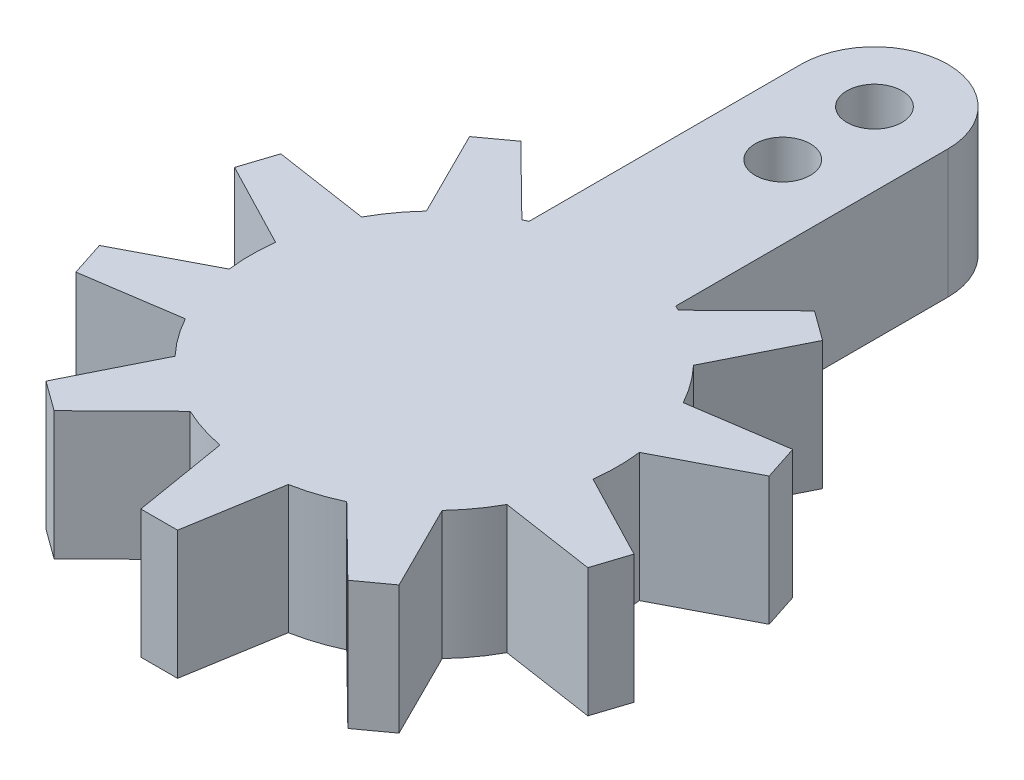
from build123d import *

# Parameters (mm, degrees)
BOSS_EXTRUDE2_DEPTH = 7
SKETCH2_R           = 1.5
BOSS_EXTRUDE3_DEPTH = 7


with BuildPart() as part:
    # Sketch1 → Boss-Extrude2 (new body)
    with BuildSketch(Plane(origin=(0, 0, 0), x_dir=(1, 0, 0), z_dir=(0, 1, 0))):
        with BuildLine():
            Line((-2, 9), (-1.862495894, 9.825024633))
            ThreePointArc((-1.862495894, 9.825024633), (-3.090169944, 9.510565163), (-4.268213752, 9.043359518))
            Line((-4.268213752, 9.043359518), (-3.672033282, 8.456723454))
            Line((-3.672033282, 8.456723454), (-6.908101259, 6.105582445))
            Line((-6.908101259, 6.105582445), (-7.281795413, 6.853864279))
            ThreePointArc((-7.281795413, 6.853864279), (-8.090169944, 5.877852523), (-8.768610817, 4.807438439))
            Line((-8.768610817, 4.807438439), (-7.941474658, 4.683265982))
            Line((-7.941474658, 4.683265982), (-9.177542635, 0.879039917))
            Line((-9.177542635, 0.879039917), (-9.919696584, 1.264760725))
            ThreePointArc((-9.919696584, 1.264760725), (-10, 0), (-9.919696584, -1.264760725))
            Line((-9.919696584, -1.264760725), (-9.177542635, -0.879039917))
            Line((-9.177542635, -0.879039917), (-7.941474658, -4.683265982))
            Line((-7.941474658, -4.683265982), (-8.768610817, -4.807438439))
            ThreePointArc((-8.768610817, -4.807438439), (-8.090169944, -5.877852523), (-7.281795413, -6.853864279))
            Line((-7.281795413, -6.853864279), (-6.908101259, -6.105582445))
            Line((-6.908101259, -6.105582445), (-3.672033282, -8.456723454))
            Line((-3.672033282, -8.456723454), (-4.268213752, -9.043359518))
            ThreePointArc((-4.268213752, -9.043359518), (-3.090169944, -9.510565163), (-1.862495894, -9.825024633))
            Line((-1.862495894, -9.825024633), (-2, -9))
            Line((-2, -9), (2, -9))
            Line((2, -9), (1.862495894, -9.825024633))
            ThreePointArc((1.862495894, -9.825024633), (3.090169944, -9.510565163), (4.268213752, -9.043359518))
            Line((4.268213752, -9.043359518), (3.672033282, -8.456723454))
            Line((3.672033282, -8.456723454), (6.908101259, -6.105582445))
            Line((6.908101259, -6.105582445), (7.281795413, -6.853864279))
            ThreePointArc((7.281795413, -6.853864279), (8.090169944, -5.877852523), (8.768610817, -4.807438439))
            Line((8.768610817, -4.807438439), (7.941474658, -4.683265982))
            Line((7.941474658, -4.683265982), (9.177542635, -0.879039917))
            Line((9.177542635, -0.879039917), (9.919696584, -1.264760725))
            ThreePointArc((9.919696584, -1.264760725), (9.979903953, -0.633653756), (10, 0))
            ThreePointArc((10, 0), (9.979903953, 0.633653756), (9.919696584, 1.264760725))
            Line((9.919696584, 1.264760725), (9.177542635, 0.879039917))
            Line((9.177542635, 0.879039917), (7.941474658, 4.683265982))
            Line((7.941474658, 4.683265982), (8.768610817, 4.807438439))
            ThreePointArc((8.768610817, 4.807438439), (8.090169944, 5.877852523), (7.281795413, 6.853864279))
            Line((7.281795413, 6.853864279), (6.908101259, 6.105582445))
            Line((6.908101259, 6.105582445), (3.672033282, 8.456723454))
            Line((3.672033282, 8.456723454), (4.268213752, 9.043359518))
            ThreePointArc((4.268213752, 9.043359518), (3.090169944, 9.510565163), (1.862495894, 9.825024633))
            Line((1.862495894, 9.825024633), (2, 9))
            Line((2, 9), (-2, 9))
        make_face()
        with BuildLine():
            ThreePointArc((-8.768610817, -4.807438439), (-9.510565163, -3.090169944), (-9.919696584, -1.264760725))
            Line((-9.919696584, -1.264760725), (-14.574864739, -3.684198399))
            Line((-14.574864739, -3.684198399), (-13.95683075, -5.586311432))
            Line((-13.95683075, -5.586311432), (-8.768610817, -4.807438439))
        make_face()
        with BuildLine():
            ThreePointArc((-4.268213752, -9.043359518), (-5.877852523, -8.090169944), (-7.281795413, -6.853864279))
            Line((-7.281795413, -6.853864279), (-9.625795779, -11.547469663))
            Line((-9.625795779, -11.547469663), (-8.00776179, -12.723040168))
            Line((-8.00776179, -12.723040168), (-4.268213752, -9.043359518))
        make_face()
        with BuildLine():
            ThreePointArc((1.862495894, -9.825024633), (0, -10), (-1.862495894, -9.825024633))
            Line((-1.862495894, -9.825024633), (-1, -15))
            Line((-1, -15), (1, -15))
            Line((1, -15), (1.862495894, -9.825024633))
        make_face()
        with BuildLine():
            Line((9.625795779, -11.547469663), (7.281795413, -6.853864279))
            ThreePointArc((7.281795413, -6.853864279), (5.877852523, -8.090169944), (4.268213752, -9.043359518))
            Line((4.268213752, -9.043359518), (8.00776179, -12.723040168))
            Line((8.00776179, -12.723040168), (9.625795779, -11.547469663))
        make_face()
        with BuildLine():
            Line((14.574864739, -3.684198399), (9.919696584, -1.264760725))
            ThreePointArc((9.919696584, -1.264760725), (9.510565163, -3.090169944), (8.768610817, -4.807438439))
            Line((8.768610817, -4.807438439), (13.95683075, -5.586311432))
            Line((13.95683075, -5.586311432), (14.574864739, -3.684198399))
        make_face()
        with BuildLine():
            Line((13.95683075, 5.586311432), (8.768610817, 4.807438439))
            ThreePointArc((8.768610817, 4.807438439), (9.510565163, 3.090169944), (9.919696584, 1.264760725))
            Line((9.919696584, 1.264760725), (14.574864739, 3.684198399))
            Line((14.574864739, 3.684198399), (13.95683075, 5.586311432))
        make_face()
        with BuildLine():
            Line((8.00776179, 12.723040168), (4.268213752, 9.043359518))
            ThreePointArc((4.268213752, 9.043359518), (5.877852523, 8.090169944), (7.281795413, 6.853864279))
            Line((7.281795413, 6.853864279), (9.625795779, 11.547469663))
            Line((9.625795779, 11.547469663), (8.00776179, 12.723040168))
        make_face()
        with BuildLine():
            Line((1, 15), (-1, 15))
            Line((-1, 15), (-1.862495894, 9.825024633))
            ThreePointArc((-1.862495894, 9.825024633), (0, 10), (1.862495894, 9.825024633))
            Line((1.862495894, 9.825024633), (1, 15))
        make_face()
        with BuildLine():
            ThreePointArc((-7.281795413, 6.853864279), (-5.877852523, 8.090169944), (-4.268213752, 9.043359518))
            Line((-4.268213752, 9.043359518), (-8.00776179, 12.723040168))
            Line((-8.00776179, 12.723040168), (-9.625795779, 11.547469663))
            Line((-9.625795779, 11.547469663), (-7.281795413, 6.853864279))
        make_face()
        with BuildLine():
            ThreePointArc((-9.919696584, 1.264760725), (-9.510565163, 3.090169944), (-8.768610817, 4.807438439))
            Line((-8.768610817, 4.807438439), (-13.95683075, 5.586311432))
            Line((-13.95683075, 5.586311432), (-14.574864739, 3.684198399))
            Line((-14.574864739, 3.684198399), (-9.919696584, 1.264760725))
        make_face()
        with BuildLine():
            Line((-7.941474658, 4.683265982), (-8.768610817, 4.807438439))
            ThreePointArc((-8.768610817, 4.807438439), (-9.510565163, 3.090169944), (-9.919696584, 1.264760725))
            Line((-9.919696584, 1.264760725), (-9.177542635, 0.879039917))
            Line((-9.177542635, 0.879039917), (-7.941474658, 4.683265982))
        make_face()
        with BuildLine():
            Line((-2, -9), (-1.862495894, -9.825024633))
            ThreePointArc((-1.862495894, -9.825024633), (0, -10), (1.862495894, -9.825024633))
            Line((1.862495894, -9.825024633), (2, -9))
            Line((2, -9), (-2, -9))
        make_face()
        with BuildLine():
            ThreePointArc((4.268213752, -9.043359518), (5.877852523, -8.090169944), (7.281795413, -6.853864279))
            Line((7.281795413, -6.853864279), (6.908101259, -6.105582445))
            Line((6.908101259, -6.105582445), (3.672033282, -8.456723454))
            Line((3.672033282, -8.456723454), (4.268213752, -9.043359518))
        make_face()
        with BuildLine():
            Line((-6.908101259, -6.105582445), (-7.281795413, -6.853864279))
            ThreePointArc((-7.281795413, -6.853864279), (-5.877852523, -8.090169944), (-4.268213752, -9.043359518))
            Line((-4.268213752, -9.043359518), (-3.672033282, -8.456723454))
            Line((-3.672033282, -8.456723454), (-6.908101259, -6.105582445))
        make_face()
        with BuildLine():
            Line((-9.177542635, -0.879039917), (-9.919696584, -1.264760725))
            ThreePointArc((-9.919696584, -1.264760725), (-9.510565163, -3.090169944), (-8.768610817, -4.807438439))
            Line((-8.768610817, -4.807438439), (-7.941474658, -4.683265982))
            Line((-7.941474658, -4.683265982), (-9.177542635, -0.879039917))
        make_face()
        with BuildLine():
            Line((-3.672033282, 8.456723454), (-4.268213752, 9.043359518))
            ThreePointArc((-4.268213752, 9.043359518), (-5.877852523, 8.090169944), (-7.281795413, 6.853864279))
            Line((-7.281795413, 6.853864279), (-6.908101259, 6.105582445))
            Line((-6.908101259, 6.105582445), (-3.672033282, 8.456723454))
        make_face()
        with BuildLine():
            ThreePointArc((1.862495894, 9.825024633), (0, 10), (-1.862495894, 9.825024633))
            Line((-1.862495894, 9.825024633), (-2, 9))
            Line((-2, 9), (2, 9))
            Line((2, 9), (1.862495894, 9.825024633))
        make_face()
        with BuildLine():
            ThreePointArc((7.281795413, 6.853864279), (5.877852523, 8.090169944), (4.268213752, 9.043359518))
            Line((4.268213752, 9.043359518), (3.672033282, 8.456723454))
            Line((3.672033282, 8.456723454), (6.908101259, 6.105582445))
            Line((6.908101259, 6.105582445), (7.281795413, 6.853864279))
        make_face()
        with BuildLine():
            ThreePointArc((9.919696584, 1.264760725), (9.510565163, 3.090169944), (8.768610817, 4.807438439))
            Line((8.768610817, 4.807438439), (7.941474658, 4.683265982))
            Line((7.941474658, 4.683265982), (9.177542635, 0.879039917))
            Line((9.177542635, 0.879039917), (9.919696584, 1.264760725))
        make_face()
        with BuildLine():
            ThreePointArc((8.768610817, -4.807438439), (9.510565163, -3.090169944), (9.919696584, -1.264760725))
            Line((9.919696584, -1.264760725), (9.177542635, -0.879039917))
            Line((9.177542635, -0.879039917), (7.941474658, -4.683265982))
            Line((7.941474658, -4.683265982), (8.768610817, -4.807438439))
        make_face()
    extrude(amount=BOSS_EXTRUDE2_DEPTH)

    # Sketch2 → Boss-Extrude3 (add)
    with BuildSketch(Plane.XZ):
        with BuildLine():
            Line((-4, 0), (4, 0))
            Line((4, 0), (4, -24))
            ThreePointArc((4, -24), (0, -28), (-4, -24))
            Line((-4, -24), (-4, 0))
        make_face()
        with Locations(Location((0, -24, 0), (0, 0, 270))):
            Circle(SKETCH2_R, mode=Mode.SUBTRACT)
        with Locations(Location((0, -19, 0), (0, 0, 270))):
            Circle(SKETCH2_R, mode=Mode.SUBTRACT)
    extrude(amount=-BOSS_EXTRUDE3_DEPTH)


solid = part.part
